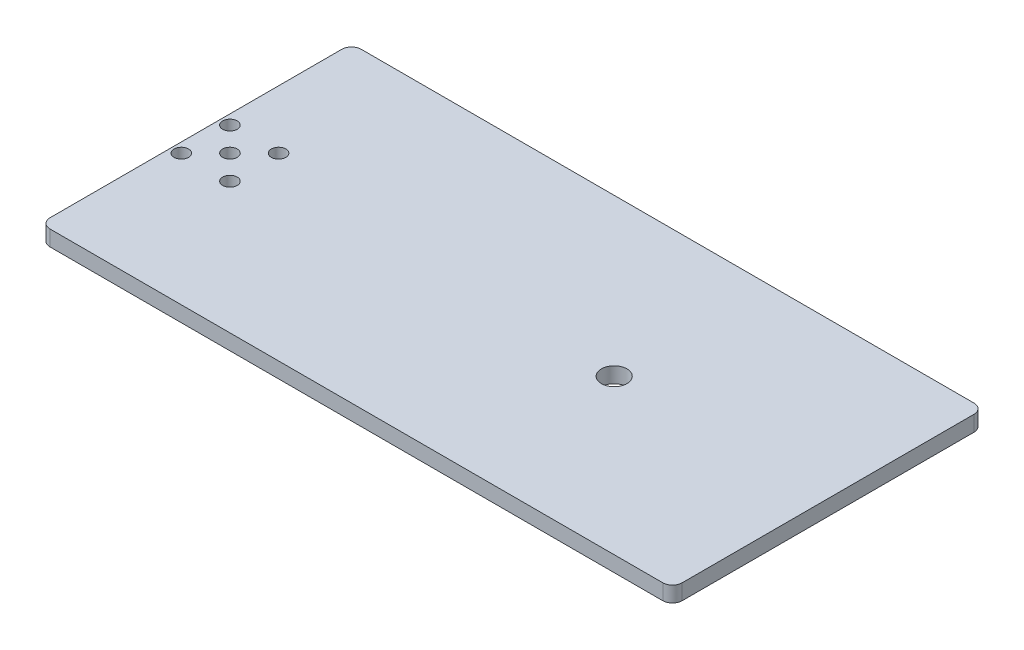
from build123d import *

# Parameters (mm, degrees)
BOSS_EXTRUDE1_DEPTH = 1.6
CUT_EXTRUDE2_REACH  = 74.468
SKETCH8_R           = 0.75
CUT_EXTRUDE3_REACH  = 74.468
SKETCH9_R           = 1.316483274


with BuildPart() as part:
    # Sketch1 → Boss-Extrude1 (new body)
    with BuildSketch(Plane(origin=(0, 0, 0), x_dir=(1, 0, 0), z_dir=(0, 1, 0))):
        with BuildLine():
            Line((1, 0), (64, 0))
            ThreePointArc((64, 0), (64.707106781, 0.292893219), (65, 1))
            Line((65, 1), (65, 31))
            ThreePointArc((65, 31), (64.707106781, 31.707106781), (64, 32))
            Line((64, 32), (1, 32))
            ThreePointArc((1, 32), (0.292893219, 31.707106781), (0, 31))
            Line((0, 31), (0, 1))
            ThreePointArc((0, 1), (0.292893219, 0.292893219), (1, 0))
        make_face()
    extrude(amount=BOSS_EXTRUDE1_DEPTH)

    # Sketch8 → Cut-Extrude2 (cut, up to next)
    with BuildSketch(Plane(origin=(0, 1.6, 0), x_dir=(1, 0, 0), z_dir=(0, 1, 0)), mode=Mode.PRIVATE) as cut_extrude2_sk1:
        with Locations(Location((3.5, 16, 0), (0, 0, 270))):
            Circle(SKETCH8_R)
    cut_extrude2_tool1 = extrude(cut_extrude2_sk1.sketch, amount=-CUT_EXTRUDE2_REACH, mode=Mode.PRIVATE) & part.part
    # Sketch8 → Cut-Extrude2 (cut, up to next)
    with BuildSketch(Plane(origin=(0, 1.6, 0), x_dir=(1, 0, 0), z_dir=(0, 1, 0)), mode=Mode.PRIVATE) as cut_extrude2_sk2:
        with Locations(Location((6, 18.5, 0), (0, 0, 270))):
            Circle(SKETCH8_R)
    cut_extrude2_tool2 = extrude(cut_extrude2_sk2.sketch, amount=-CUT_EXTRUDE2_REACH, mode=Mode.PRIVATE) & part.part
    # Sketch8 → Cut-Extrude2 (cut, up to next)
    with BuildSketch(Plane(origin=(0, 1.6, 0), x_dir=(1, 0, 0), z_dir=(0, 1, 0)), mode=Mode.PRIVATE) as cut_extrude2_sk3:
        with Locations(Location((6, 13.5, 0), (0, 0, 270))):
            Circle(SKETCH8_R)
    cut_extrude2_tool3 = extrude(cut_extrude2_sk3.sketch, amount=-CUT_EXTRUDE2_REACH, mode=Mode.PRIVATE) & part.part
    # Sketch8 → Cut-Extrude2 (cut, up to next)
    with BuildSketch(Plane(origin=(0, 1.6, 0), x_dir=(1, 0, 0), z_dir=(0, 1, 0)), mode=Mode.PRIVATE) as cut_extrude2_sk4:
        with Locations(Location((1, 13.499992953, 0), (0, 0, 270))):
            Circle(SKETCH8_R)
    cut_extrude2_tool4 = extrude(cut_extrude2_sk4.sketch, amount=-CUT_EXTRUDE2_REACH, mode=Mode.PRIVATE) & part.part
    # Sketch8 → Cut-Extrude2 (cut, up to next)
    with BuildSketch(Plane(origin=(0, 1.6, 0), x_dir=(1, 0, 0), z_dir=(0, 1, 0)), mode=Mode.PRIVATE) as cut_extrude2_sk5:
        with Locations(Location((1, 18.499992953, 0), (0, 0, 270))):
            Circle(SKETCH8_R)
    cut_extrude2_tool5 = extrude(cut_extrude2_sk5.sketch, amount=-CUT_EXTRUDE2_REACH, mode=Mode.PRIVATE) & part.part
    add(cut_extrude2_tool1.solids().sort_by_distance((3.5, 1.6, -16))[0], mode=Mode.SUBTRACT)
    add(cut_extrude2_tool2.solids().sort_by_distance((6, 1.6, -18.5))[0], mode=Mode.SUBTRACT)
    add(cut_extrude2_tool3.solids().sort_by_distance((6, 1.6, -13.5))[0], mode=Mode.SUBTRACT)
    add(cut_extrude2_tool4.solids().sort_by_distance((1, 1.6, -13.499993))[0], mode=Mode.SUBTRACT)
    add(cut_extrude2_tool5.solids().sort_by_distance((1, 1.6, -18.499993))[0], mode=Mode.SUBTRACT)

    # Sketch9 → Cut-Extrude3 (cut, up to next)
    with BuildSketch(Plane(origin=(0, 1.6, 0), x_dir=(1, 0, 0), z_dir=(0, 1, 0)), mode=Mode.PRIVATE) as cut_extrude3_sk1:
        with Locations(Location((43.114982321, 15.890924109, 0), (0, 0, 270))):
            Circle(SKETCH9_R)
    cut_extrude3_tool1 = extrude(cut_extrude3_sk1.sketch, amount=-CUT_EXTRUDE3_REACH, mode=Mode.PRIVATE) & part.part
    add(cut_extrude3_tool1.solids().sort_by_distance((43.114982, 1.6, -15.890924))[0], mode=Mode.SUBTRACT)


solid = part.part
